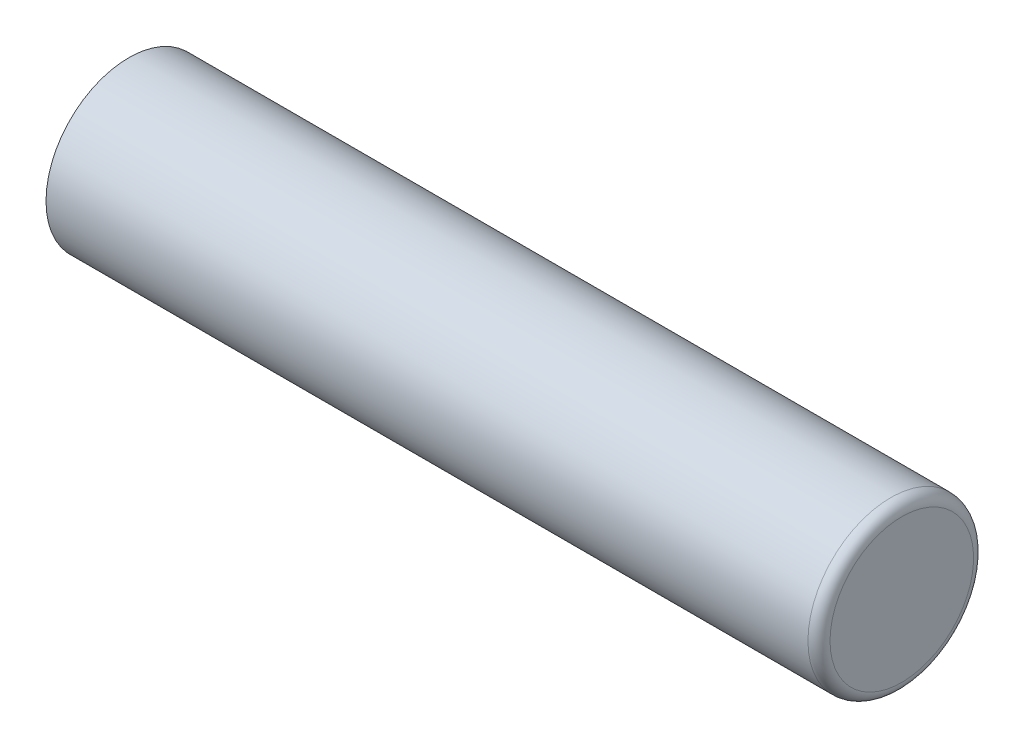
from build123d import *

# Parameters (mm, degrees)
ESQUISSE1_W             = 14
ESQUISSE1_H             = 1.5
CONG_1_R                = 0.2
ESQUISSE2_R             = 1.25
ENL_V_MAT_EXTRU_1_DEPTH = 0.5


with BuildPart() as part:
    # Esquisse1 → Révolution1 (revolve)
    with BuildSketch(Plane.XY, mode=Mode.PRIVATE) as r_volution1_sk:
        with Locations((6.66, 0.75)):
            Rectangle(ESQUISSE1_W, ESQUISSE1_H)
    revolve(r_volution1_sk.sketch.rotate(Axis((-5.768945874, 0, 0), (1, 0, 0)), 90), axis=Axis((-5.768945874, 0, 0), (1, 0, 0)))

    # Congé1
    cong_1_edges = [part.edges().sort_by_distance(p)[0] for p in [
        (13.66, 0, -1.5),
    ]]
    fillet(cong_1_edges, radius=CONG_1_R)

    # Esquisse2 → Enlèv. mat.-Extru.1 (cut)
    with BuildSketch(Plane.ZY.offset(0.34)):
        Circle(ESQUISSE2_R)
    extrude(amount=-ENL_V_MAT_EXTRU_1_DEPTH, mode=Mode.SUBTRACT)


solid = part.part
